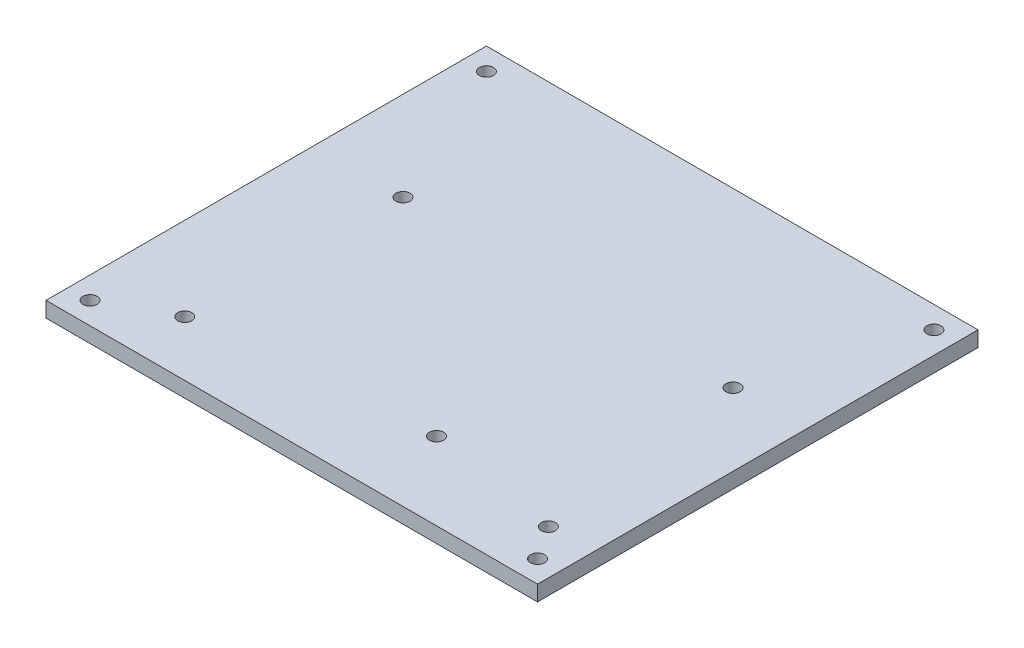
from build123d import *

# Parameters (mm, degrees)
SKETCH1_W           = 111.6
SKETCH1_H           = 100
SKETCH1_R           = 1.6
BOSS_EXTRUDE1_DEPTH = 3.5


with BuildPart() as part:
    # Sketch1 → Boss-Extrude1 (new body)
    with BuildSketch(Plane(origin=(0, 0, 0), x_dir=(1, 0, 0), z_dir=(0, 1, 0))):
        with Locations((55.8, 50)):
            Rectangle(SKETCH1_W, SKETCH1_H)
        with Locations(Location((20.24, 60.8, 0), (0, 0, 270))):
            Circle(SKETCH1_R, mode=Mode.SUBTRACT)
        with Locations(Location((18.97, 12.54, 0), (0, 0, 270))):
            Circle(SKETCH1_R, mode=Mode.SUBTRACT)
        with Locations(Location((71.04, 17.62, 0), (0, 0, 270))):
            Circle(SKETCH1_R, mode=Mode.SUBTRACT)
        with Locations(Location((101.52, 12.54, 0), (0, 0, 270))):
            Circle(SKETCH1_R, mode=Mode.SUBTRACT)
        with Locations(Location((95.17, 60.8, 0), (0, 0, 270))):
            Circle(SKETCH1_R, mode=Mode.SUBTRACT)
        with Locations(Location((106.6, 5, 0), (0, 0, 270))):
            Circle(SKETCH1_R, mode=Mode.SUBTRACT)
        with Locations(Location((106.6, 95, 0), (0, 0, 270))):
            Circle(SKETCH1_R, mode=Mode.SUBTRACT)
        with Locations(Location((5, 5, 0), (0, 0, 90))):
            Circle(SKETCH1_R, mode=Mode.SUBTRACT)
        with Locations(Location((5, 95, 0), (0, 0, 90))):
            Circle(SKETCH1_R, mode=Mode.SUBTRACT)
    extrude(amount=BOSS_EXTRUDE1_DEPTH)


solid = part.part
